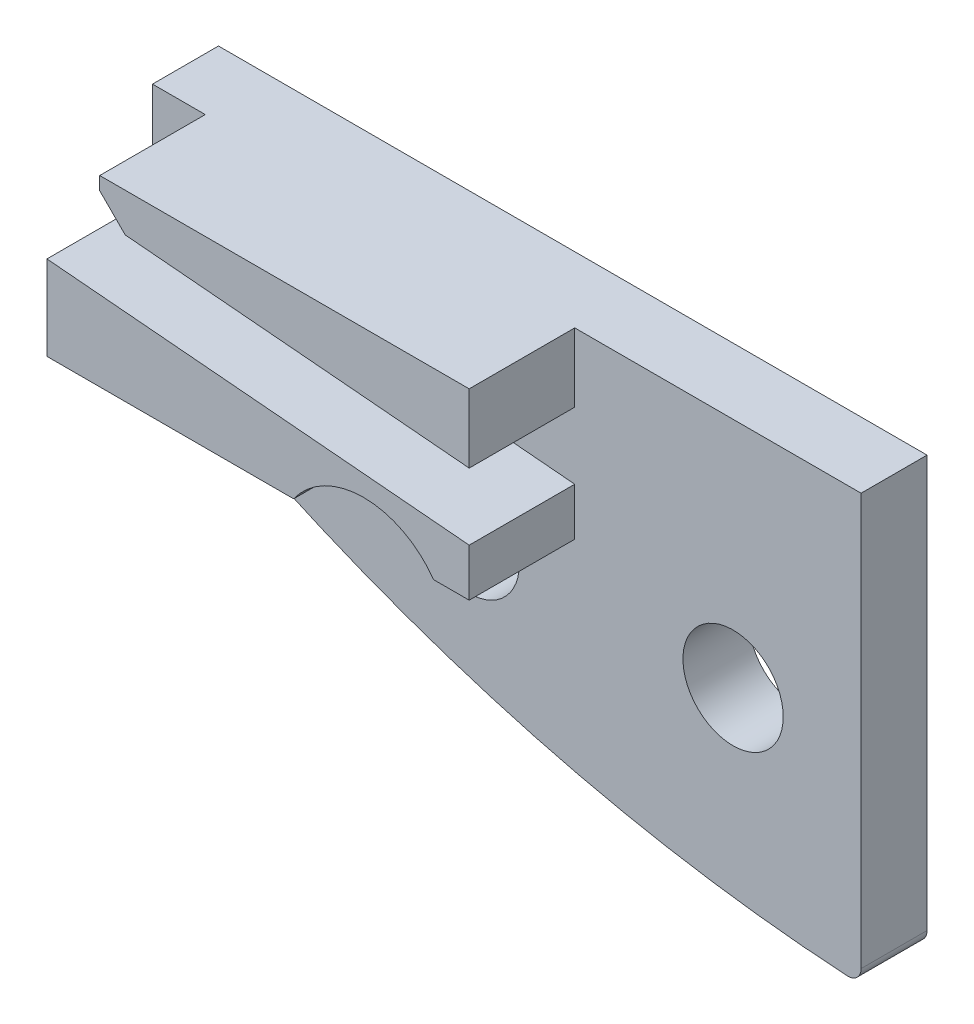
from build123d import *

# Parameters (mm, degrees)
SKETCH1_R           = 2.413
BOSS_EXTRUDE1_DEPTH = 3.175
BOSS_EXTRUDE2_DEPTH = 5.08
SKETCH4_W           = 4
SKETCH4_H           = 24.78484928
CUT_EXTRUDE2_DEPTH  = 5.08
FILLET1_R           = 0.635
SKETCH5_R           = 4.1275
CUT_EXTRUDE3_DEPTH  = 5.08


with BuildPart() as part:
    # Sketch1 → Boss-Extrude1 (new body)
    with BuildSketch(Plane.XY):
        with BuildLine():
            Line((0, 20.591373255), (-38.1, 20.591373255))
            Line((-38.1, 20.591373255), (-38.1, 10.208864232))
            ThreePointArc((-38.1, 10.208864232), (-19.722011237, 2.596452037), (0, 0))
            Line((0, 0), (0, 20.591373255))
        make_face()
        with Locations((-10.16, 9.398)):
            Circle(SKETCH1_R, mode=Mode.SUBTRACT)
        with Locations((-22.86, 9.398)):
            Circle(SKETCH1_R, mode=Mode.SUBTRACT)
    extrude(amount=BOSS_EXTRUDE1_DEPTH)

    # Sketch2 → Boss-Extrude2 (add)
    with BuildSketch(Plane.XY.offset(3.175)):
        Polygon((-38.1, 15.846028276), (-17.78, 14.075883223), (-17.78, 11.782028276), (-38.1, 11.782028276), align=None)
        Polygon((-17.78, 17.286663737), (-34.332210433, 18.728583688), (-35.56, 19.956373255), (-35.56, 20.591373255), (-17.78, 20.591373255), align=None)
    extrude(amount=BOSS_EXTRUDE2_DEPTH)

    # Sketch4 → Cut-Extrude2 (cut)
    with BuildSketch(Plane.XY.offset(3.175)):
        with Locations((-2, 12.39242464)):
            Rectangle(SKETCH4_W, SKETCH4_H)
    extrude(amount=-CUT_EXTRUDE2_DEPTH, mode=Mode.SUBTRACT)

    # Fillet1
    fillet1_edges = [part.edges().sort_by_distance(p)[0] for p in [
        (-4, 0.105059301, 1.5875),
        (-38.1, 10.208864232, 1.5875),
    ]]
    fillet(fillet1_edges, radius=FILLET1_R)

    # Sketch5 → Cut-Extrude3 (cut)
    with BuildSketch(Plane.XY.offset(8.255)):
        with Locations((-22.86, 9.398)):
            Circle(SKETCH5_R)
    extrude(amount=-CUT_EXTRUDE3_DEPTH, mode=Mode.SUBTRACT)


solid = part.part
